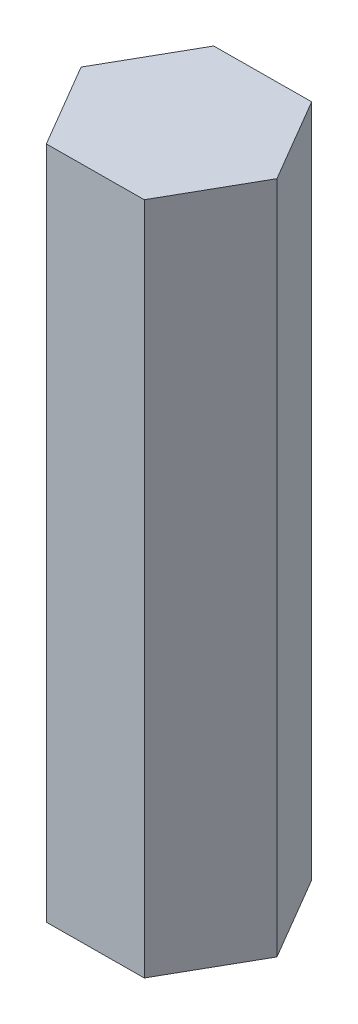
from build123d import *

# Parameters (mm, degrees)
BOSS_EXTRUDE1_DEPTH = 50.8


with BuildPart() as part:
    # Sketch1 → Boss-Extrude1 (new body)
    with BuildSketch(Plane(origin=(0, 0, 0), x_dir=(1, 0, 0), z_dir=(0, 1, 0))):
        Polygon((3.624396134, 6.373938029), (-3.707794188, 6.32578814), (-7.332190322, -0.048149889), (-3.624396134, -6.373938029), (3.707794188, -6.32578814), (7.332190322, 0.048149889), align=None)
    extrude(amount=BOSS_EXTRUDE1_DEPTH)


solid = part.part
